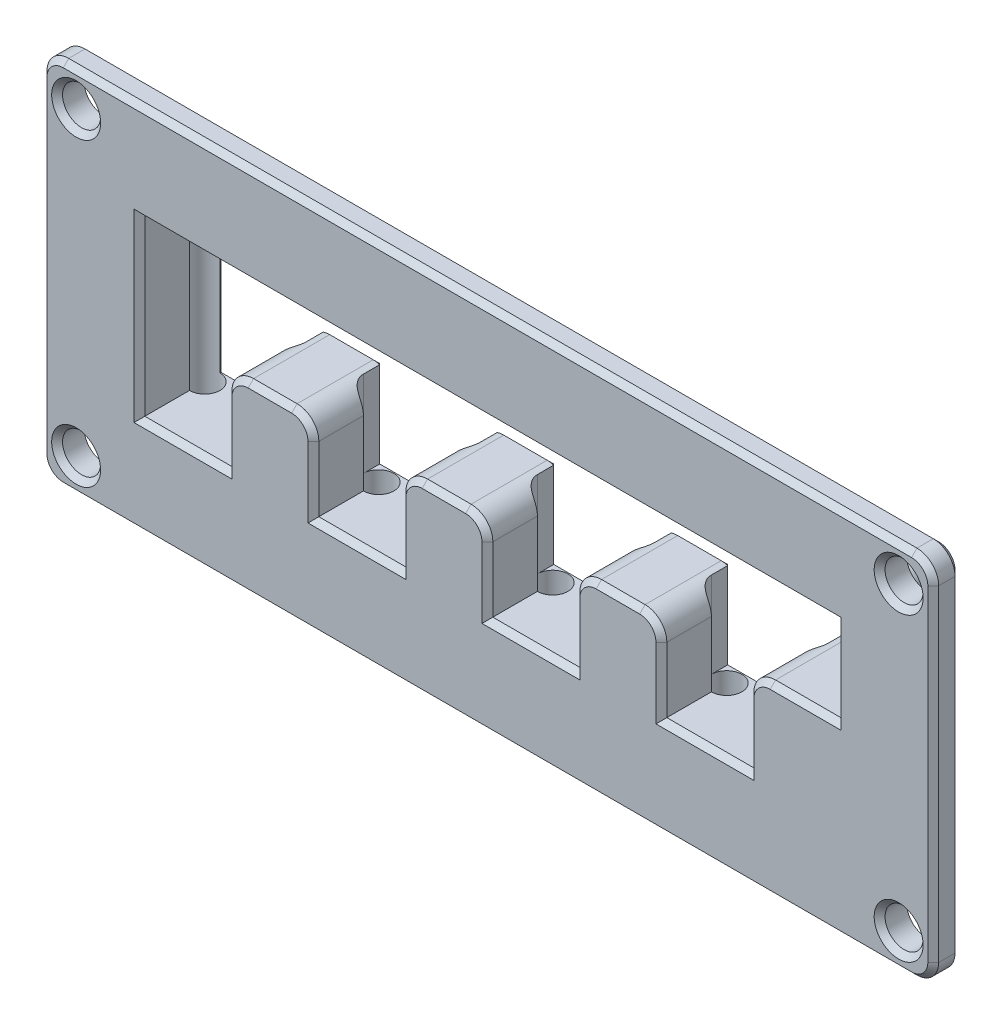
from build123d import *

# Parameters (mm, degrees)
SKETCH1_W                 = 70
SKETCH1_H                 = 22
BOSS_EXTRUDE1_DEPTH       = 8
SKETCH2_W                 = 82
SKETCH2_H                 = 34
SKETCH2_W_2               = 70
SKETCH2_H_2               = 22
BOSS_EXTRUDE2_DEPTH       = 2.5
CUT_EXTRUDE3_REACH        = 50.335
SKETCH6_R                 = 1.75
FILLET1_R                 = 2
SKETCH3_R                 = 1.4
CUT_EXTRUDE1_DEPTH        = 49.682645779
LPATTERN1_COUNT           = 9
LPATTERN1_PITCH           = 8
SKETCH7_W                 = 1.4
SKETCH7_H                 = 7.907878403
CUT_EXTRUDE5_DEPTH        = 2
LPATTERN3_COUNT           = 4
LPATTERN3_PITCH           = 16
LPATTERN4_COPY_1_SKETCH_W = 1.4
LPATTERN4_COPY_1_SKETCH_H = 7.907878403
LPATTERN4_COPY_1_DEPTH    = 2
LPATTERN4_COPY_2_SKETCH_W = 1.4
LPATTERN4_COPY_2_SKETCH_H = 7.907878403
LPATTERN4_COPY_2_DEPTH    = 2
LPATTERN4_COPY_3_SKETCH_W = 1.4
LPATTERN4_COPY_3_SKETCH_H = 7.907878403
LPATTERN4_COPY_3_DEPTH    = 2
LPATTERN4_COPY_4_SKETCH_W = 1.4
LPATTERN4_COPY_4_SKETCH_H = 7.907878403
LPATTERN4_COPY_4_DEPTH    = 2
CHAMFER1_SIZE             = 0.5


with BuildPart() as part:
    # Sketch1 → Boss-Extrude1 (new body)
    with BuildSketch(Plane.XY):
        with Locations((0, -8)):
            Rectangle(SKETCH1_W, SKETCH1_H)
        Polygon((-32, 0), (-32, -16), (-24, -16), (-24, -8), (-16, -8), (-16, -16), (-8, -16), (-8, -8), (0, -8), (0, -16), (8, -16), (8, -8), (16, -8), (16, -16), (24, -16), (24, -8), (32, -8), (32, 0), align=None, mode=Mode.SUBTRACT)
    extrude(amount=-BOSS_EXTRUDE1_DEPTH)

    # Sketch2 → Boss-Extrude2 (add)
    with BuildSketch(Plane.XY):
        with Locations((0, -8)):
            Rectangle(SKETCH2_W, SKETCH2_H)
        with Locations((0, -8)):
            Rectangle(SKETCH2_W_2, SKETCH2_H_2, mode=Mode.SUBTRACT)
    extrude(amount=-BOSS_EXTRUDE2_DEPTH)

    # Sketch6 → Cut-Extrude3 (cut, up to next)
    with BuildSketch(Plane(origin=(0, 0, -2.5), x_dir=(-1, 0, 0), z_dir=(0, 0, -1)), mode=Mode.PRIVATE) as cut_extrude3_sk1:
        with Locations((37.818019485, -21.818019485)):
            Circle(SKETCH6_R)
    cut_extrude3_tool1 = extrude(cut_extrude3_sk1.sketch, amount=-CUT_EXTRUDE3_REACH, mode=Mode.PRIVATE) & part.part
    # Sketch6 → Cut-Extrude3 (cut, up to next)
    with BuildSketch(Plane(origin=(0, 0, -2.5), x_dir=(-1, 0, 0), z_dir=(0, 0, -1)), mode=Mode.PRIVATE) as cut_extrude3_sk2:
        with Locations((-37.818019485, 5.818019485)):
            Circle(SKETCH6_R)
    cut_extrude3_tool2 = extrude(cut_extrude3_sk2.sketch, amount=-CUT_EXTRUDE3_REACH, mode=Mode.PRIVATE) & part.part
    # Sketch6 → Cut-Extrude3 (cut, up to next)
    with BuildSketch(Plane(origin=(0, 0, -2.5), x_dir=(-1, 0, 0), z_dir=(0, 0, -1)), mode=Mode.PRIVATE) as cut_extrude3_sk3:
        with Locations((37.818019485, 5.818019485)):
            Circle(SKETCH6_R)
    cut_extrude3_tool3 = extrude(cut_extrude3_sk3.sketch, amount=-CUT_EXTRUDE3_REACH, mode=Mode.PRIVATE) & part.part
    # Sketch6 → Cut-Extrude3 (cut, up to next)
    with BuildSketch(Plane(origin=(0, 0, -2.5), x_dir=(-1, 0, 0), z_dir=(0, 0, -1)), mode=Mode.PRIVATE) as cut_extrude3_sk4:
        with Locations((-37.818019485, -21.818019485)):
            Circle(SKETCH6_R)
    cut_extrude3_tool4 = extrude(cut_extrude3_sk4.sketch, amount=-CUT_EXTRUDE3_REACH, mode=Mode.PRIVATE) & part.part
    add(cut_extrude3_tool1.solids().sort_by_distance((-37.818019, -21.818019, -2.5))[0], mode=Mode.SUBTRACT)
    add(cut_extrude3_tool2.solids().sort_by_distance((37.818019, 5.818019, -2.5))[0], mode=Mode.SUBTRACT)
    add(cut_extrude3_tool3.solids().sort_by_distance((-37.818019, 5.818019, -2.5))[0], mode=Mode.SUBTRACT)
    add(cut_extrude3_tool4.solids().sort_by_distance((37.818019, -21.818019, -2.5))[0], mode=Mode.SUBTRACT)

    # Fillet1
    fillet1_edges = [part.edges().sort_by_distance(p)[0] for p in [
        (24, -8, -4),
        (16, -8, -4),
        (8, -8, -4),
        (0, -8, -4),
        (-8, -8, -4),
        (-16, -8, -4),
        (-24, -8, -4),
        (-41, -25, -1.25),
        (-41, 9, -1.25),
        (41, 9, -1.25),
        (-35, 3, -5.25),
        (41, -25, -1.25),
        (35, 3, -5.25),
        (35, -19, -5.25),
        (-35, -19, -5.25),
    ]]
    fillet(fillet1_edges, radius=FILLET1_R)

    # Sketch3 → Cut-Extrude1 (cut, symmetric)
    with BuildSketch(Plane(origin=(0, 0, 0), x_dir=(1, 0, 0), z_dir=(0, 1, 0))):
        with Locations(Location((-32, 6, 0), (0, 0, 224.415308597))):
            Circle(SKETCH3_R)
    cut_extrude1 = extrude(amount=CUT_EXTRUDE1_DEPTH, both=True, mode=Mode.SUBTRACT)

    # LPattern1: Cut-Extrude1 ×9
    with Locations(*[(i * LPATTERN1_PITCH, 0, 0) for i in range(1, LPATTERN1_COUNT)]):
        add(cut_extrude1, mode=Mode.SUBTRACT)

    # Sketch7 → Cut-Extrude5 (cut)
    with BuildSketch(Plane.XY.offset(-6)):
        with Locations((-23.3, -12.046060799)):
            Rectangle(SKETCH7_W, SKETCH7_H)
    cut_extrude5 = extrude(amount=-CUT_EXTRUDE5_DEPTH, mode=Mode.SUBTRACT)

    # Mirror2: Cut-Extrude5 across plane
    add(cut_extrude5.mirror(Plane(origin=(-20, 0, 0), x_dir=(0, 0, 1), z_dir=(1, 0, 0))), mode=Mode.SUBTRACT)

    # LPattern3: Cut-Extrude5 ×4
    with Locations(*[(i * LPATTERN3_PITCH, 0, 0) for i in range(1, LPATTERN3_COUNT)]):
        add(cut_extrude5, mode=Mode.SUBTRACT)

    # LPattern4 copy 1 sketch → LPattern4 copy 1 (cut)
    with BuildSketch(Plane(origin=(-24, 0, -6), x_dir=(-1, 0, 0), z_dir=(0, 0, 1))):
        with Locations((-23.3, 12.046060799)):
            Rectangle(LPATTERN4_COPY_1_SKETCH_W, LPATTERN4_COPY_1_SKETCH_H)
    extrude(amount=-LPATTERN4_COPY_1_DEPTH, mode=Mode.SUBTRACT)

    # LPattern4 copy 2 sketch → LPattern4 copy 2 (cut)
    with BuildSketch(Plane(origin=(-8, 0, -6), x_dir=(-1, 0, 0), z_dir=(0, 0, 1))):
        with Locations((-23.3, 12.046060799)):
            Rectangle(LPATTERN4_COPY_2_SKETCH_W, LPATTERN4_COPY_2_SKETCH_H)
    extrude(amount=-LPATTERN4_COPY_2_DEPTH, mode=Mode.SUBTRACT)

    # LPattern4 copy 3 sketch → LPattern4 copy 3 (cut)
    with BuildSketch(Plane(origin=(16, 0, -6), x_dir=(1, 0, 0), z_dir=(0, 0, 1))):
        with Locations((-23.3, -12.046060799)):
            Rectangle(LPATTERN4_COPY_3_SKETCH_W, LPATTERN4_COPY_3_SKETCH_H)
    extrude(amount=-LPATTERN4_COPY_3_DEPTH, mode=Mode.SUBTRACT)

    # LPattern4 copy 4 sketch → LPattern4 copy 4 (cut)
    with BuildSketch(Plane(origin=(32, 0, -6), x_dir=(1, 0, 0), z_dir=(0, 0, 1))):
        with Locations((-23.3, -12.046060799)):
            Rectangle(LPATTERN4_COPY_4_SKETCH_W, LPATTERN4_COPY_4_SKETCH_H)
    extrude(amount=-LPATTERN4_COPY_4_DEPTH, mode=Mode.SUBTRACT)

    # Chamfer1
    chamfer1_edges = [part.edges().sort_by_distance(p)[0] for p in [
        (-36.068019485, 5.818019485, 0),
        (39.568019485, -21.818019485, 0),
        (29, -8, 0),
        (29, -8, -8),
        (16, -13, 0),
        (12, -8, 0),
        (0, -13, 0),
        (-4, -8, 0),
        (-16, -13, 0),
        (-20, -8, 0),
        (-41, -8, 0),
        (0, -25, 0),
        (41, -8, 0),
        (0, 9, 0),
        (40.414213562, 8.414213562, 0),
        (40.414213562, -24.414213562, 0),
        (-40.414213562, 8.414213562, 0),
        (-40.414213562, -24.414213562, 0),
        (-23.414213562, -8.585786438, 0),
        (-16.585786438, -8.585786438, 0),
        (-7.414213562, -8.585786438, 0),
        (-0.585786438, -8.585786438, 0),
        (8.585786438, -8.585786438, 0),
        (15.414213562, -8.585786438, 0),
        (24.585786438, -8.585786438, 0),
        (-20, -8, -8),
        (-4, -8, -8),
        (12, -8, -8),
        (-35, -8, -8),
        (0, 3, -8),
        (35, -8, -8),
        (0, -19, -8),
        (34.414213562, 2.414213562, -8),
        (34.414213562, -18.414213562, -8),
        (-34.414213562, 2.414213562, -8),
        (-34.414213562, -18.414213562, -8),
        (-17.696484601, -8.023164548, -8),
        (-1.696484601, -8.023164548, -8),
        (14.303515399, -8.023164548, -8),
        (-41, -8, -2.5),
        (0, -25, -2.5),
        (0, 9, -2.5),
        (41, -8, -2.5),
        (40.414213562, 8.414213562, -2.5),
        (40.414213562, -24.414213562, -2.5),
        (-40.414213562, 8.414213562, -2.5),
        (-40.414213562, -24.414213562, -2.5),
        (0, 0, -8),
        (32, -4, -8),
        (20, -16, -8),
        (4, -16, -8),
        (-12, -16, -8),
        (-22.303515399, -8.023164548, -8),
        (-27.3, -16, -8),
        (-22.6, -12.046060799, -8),
        (-32, -8, -8),
        (0, 0, 0),
        (-32, -8, 0),
        (-28, -16, 0),
        (-24, -13, 0),
        (-17.4, -12.046060799, -8),
        (-12, -16, 0),
        (-8, -13, 0),
        (-6.303515399, -8.023164548, -8),
        (-6.6, -12.046060799, -8),
        (4, -16, 0),
        (8, -13, 0),
        (9.696484601, -8.023164548, -8),
        (9.4, -12.046060799, -8),
        (20, -16, 0),
        (24, -13, 0),
        (25.696484601, -8.023164548, -8),
        (32, -4, 0),
        (25.4, -12.046060799, -8),
        (-1.4, -12.046060799, -8),
        (14.6, -12.046060799, -8),
        (-36.068019485, -21.818019485, 0),
        (39.568019485, 5.818019485, 0),
    ]]
    chamfer(chamfer1_edges, length=CHAMFER1_SIZE)


solid = part.part
